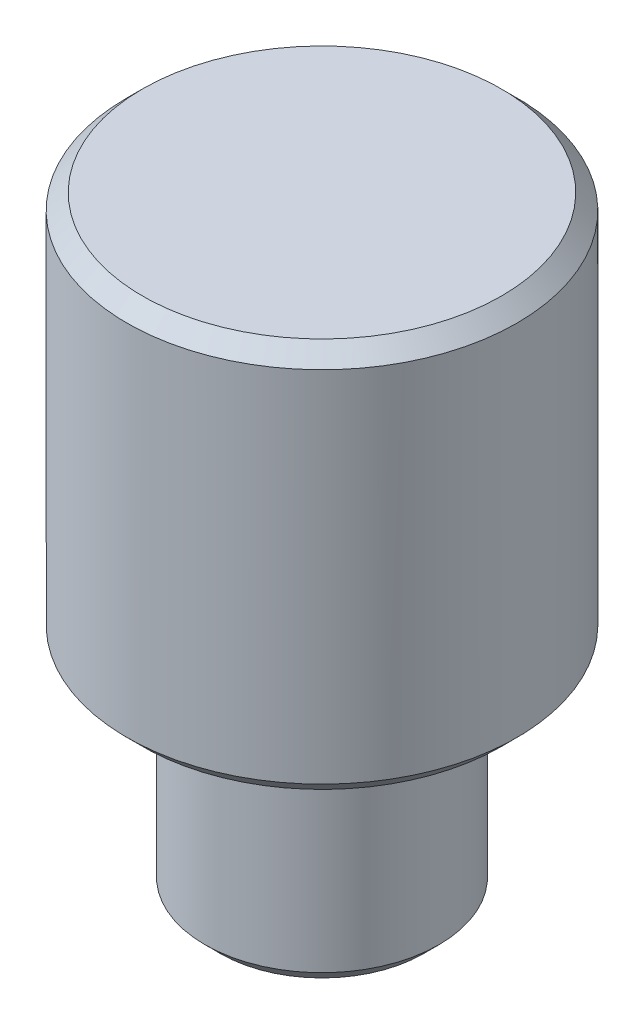
from build123d import *

# Parameters (mm, degrees)
CHAMFER1_SIZE = 2


with BuildPart() as part:
    # Sketch1 → Revolve1 (revolve)
    with BuildSketch(Plane.XY, mode=Mode.PRIVATE) as revolve1_sk:
        Polygon((0, 0), (25, 0), (25, -50), (15, -50), (15, -78), (0, -78), align=None)
    revolve(revolve1_sk.sketch.rotate(Axis((0, 5, 0), (0, -1, 0)), 180), axis=Axis((0, 5, 0), (0, -1, 0)))

    # Chamfer1
    chamfer1_edges = [part.edges().sort_by_distance(p)[0] for p in [
        (15, -78, 0),
        (25, -50, 0),
        (25, 0, 0),
    ]]
    chamfer(chamfer1_edges, length=CHAMFER1_SIZE)


solid = part.part
